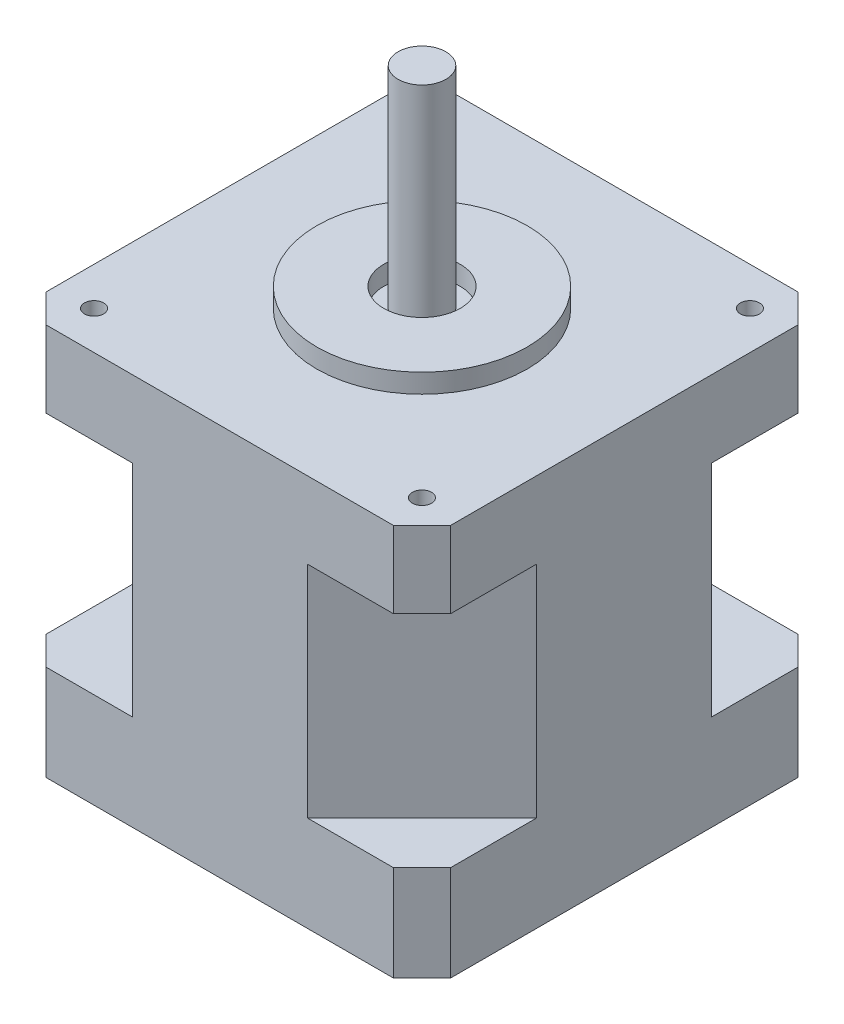
from build123d import *

# Parameters (mm, degrees)
BOSS_EXTRUDE1_START       = -22
BOSS_EXTRUDE1_DEPTH       = 8
BOSS_EXTRUDE3_DEPTH       = 23
BOSS_EXTRUDE4_DEPTH       = 6
SKETCH4_R                 = 11
SKETCH4_R_2               = 4
BOSS_EXTRUDE5_DEPTH       = 2
SKETCH5_R                 = 2.5
BOSS_EXTRUDE6_DEPTH       = 22
F_2_0MM_DOWEL_HOLE1_D     = 2
F_2_0MM_DOWEL_HOLE1_DEPTH = 5
F_2_0MM_DOWEL_HOLE1_TIP   = 0.600860619
SKETCH8_R                 = 5
SKETCH8_W                 = 4
SKETCH8_H                 = 16
BOSS_EXTRUDE7_DEPTH       = 4


with BuildPart() as part:
    # Sketch1 → Boss-Extrude1 (new body)
    with BuildSketch(Plane(origin=(0, 0, 0), x_dir=(1, 0, 0), z_dir=(0, 1, 0)).offset(BOSS_EXTRUDE1_START)):
        Polygon((-18.15, 21.15), (-21.15, 18.15), (-21.15, -18.15), (-18.15, -21.15), (18.15, -21.15), (21.15, -18.15), (21.15, 18.15), (18.15, 21.15), align=None)
    extrude(amount=-BOSS_EXTRUDE1_DEPTH)

    # Sketch2 → Boss-Extrude3 (add)
    with BuildSketch(Plane(origin=(0, -30, 0), x_dir=(-1, 0, 0), z_dir=(0, -1, 0))):
        Polygon((-21.15, 9.15), (-9.15, 21.15), (9.15, 21.15), (21.15, 9.15), (21.15, -9.15), (9.15, -21.15), (-9.15, -21.15), (-21.15, -9.15), align=None)
    extrude(amount=BOSS_EXTRUDE3_DEPTH)

    # Sketch3 → Boss-Extrude4 (add)
    with BuildSketch(Plane(origin=(0, -53, 0), x_dir=(-1, 0, 0), z_dir=(0, -1, 0))):
        Polygon((-18.15, 21.15), (-21.15, 18.15), (-21.15, -18.15), (-18.15, -21.15), (18.15, -21.15), (21.15, -18.15), (21.15, 18.15), (18.15, 21.15), align=None)
    extrude(amount=BOSS_EXTRUDE4_DEPTH)

    # Sketch4 → Boss-Extrude5 (add)
    with BuildSketch(Plane(origin=(0, -22, 0), x_dir=(-1, 0, 0), z_dir=(0, 1, 0))):
        with Locations(Location((0, 0, 0), (0, 0, 90))):
            Circle(SKETCH4_R)
        with Locations(Location((0, 0, 0), (0, 0, 90))):
            Circle(SKETCH4_R_2, mode=Mode.SUBTRACT)
    extrude(amount=BOSS_EXTRUDE5_DEPTH)

    # Sketch5 → Boss-Extrude6 (add)
    with BuildSketch(Plane(origin=(0, -22, 0), x_dir=(-1, 0, 0), z_dir=(0, 1, 0))):
        with Locations(Location((0, 0, 0), (0, 0, 90))):
            Circle(SKETCH5_R)
    extrude(amount=BOSS_EXTRUDE6_DEPTH)

    # Ø2.0mm Dowel Hole1
    with Locations(Plane(origin=(0, -22, 0), x_dir=(1, 0, 0), z_dir=(0, 1, 0))):
        with Locations((-17.15, 17.15), (-17.15, -17.15), (17.15, -17.15), (17.15, 17.15)):
            Hole(F_2_0MM_DOWEL_HOLE1_D / 2, depth=F_2_0MM_DOWEL_HOLE1_DEPTH)
            with Locations((0, 0, -(F_2_0MM_DOWEL_HOLE1_DEPTH + F_2_0MM_DOWEL_HOLE1_TIP / 2))):  # 118° drill point
                Cone(0, F_2_0MM_DOWEL_HOLE1_D / 2, F_2_0MM_DOWEL_HOLE1_TIP, mode=Mode.SUBTRACT)

    # Sketch8 → Boss-Extrude7 (add)
    # profile 1 of 2: a face of its own
    with BuildSketch(Plane.XZ.offset(59)):
        Polygon((-21.15, -18.15), (-18.15, -21.15), (18.15, -21.15), (21.15, -18.15), (21.15, 18.15), (18.15, 21.15), (-18.15, 21.15), (-21.15, 18.15), align=None)
        with Locations(Location((0, 0, 0), (0, 0, 270))):
            Circle(SKETCH8_R, mode=Mode.SUBTRACT)
    # profile 2 of 2: a face of its own
    with BuildSketch(Plane.XZ.offset(59)):
        with Locations((-23.15, 0)):
            Rectangle(SKETCH8_W, SKETCH8_H)
    extrude(amount=BOSS_EXTRUDE7_DEPTH)


solid = part.part
